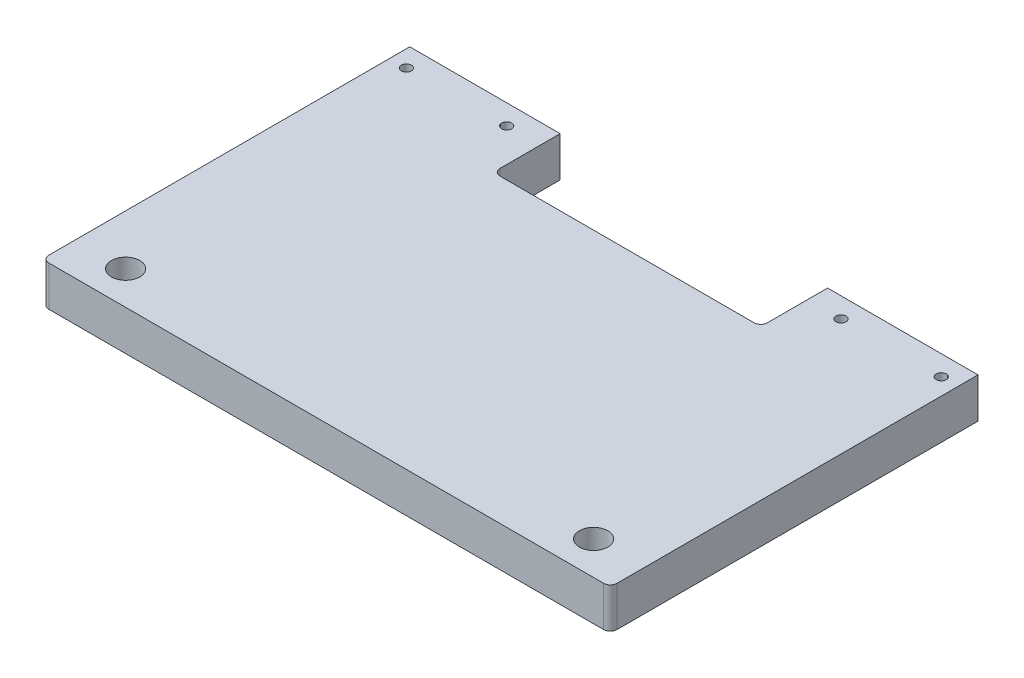
from build123d import *

# Parameters (mm, degrees)
SKETCH1_R           = 4.25
SKETCH1_R_2         = 1.5
BOSS_EXTRUDE1_DEPTH = 12
FILLET1_R           = 2


with BuildPart() as part:
    # Sketch1 → Boss-Extrude1 (new body)
    with BuildSketch(Plane(origin=(0, 0, 0), x_dir=(1, 0, 0), z_dir=(0, 1, 0))):
        Polygon((0, 0), (170, 0), (170, 110), (125, 110), (125, 90), (45, 90), (45, 110), (0, 110), align=None)
        with Locations(Location((155, 10, 0), (0, 0, 270))):
            Circle(SKETCH1_R, mode=Mode.SUBTRACT)
        with Locations(Location((15, 10, 0), (0, 0, 90))):
            Circle(SKETCH1_R, mode=Mode.SUBTRACT)
        with Locations(Location((5, 104, 0), (0, 0, 270))):
            Circle(SKETCH1_R_2, mode=Mode.SUBTRACT)
        with Locations(Location((35, 104, 0), (0, 0, 270))):
            Circle(SKETCH1_R_2, mode=Mode.SUBTRACT)
        with Locations(Location((165, 104, 0), (0, 0, 90))):
            Circle(SKETCH1_R_2, mode=Mode.SUBTRACT)
        with Locations(Location((135, 104, 0), (0, 0, 90))):
            Circle(SKETCH1_R_2, mode=Mode.SUBTRACT)
    extrude(amount=BOSS_EXTRUDE1_DEPTH)

    # Fillet1
    fillet1_edges = [part.edges().sort_by_distance(p)[0] for p in [
        (45, 6, -90),
        (125, 6, -90),
        (170, 6, 0),
        (0, 6, 0),
    ]]
    fillet(fillet1_edges, radius=FILLET1_R)


solid = part.part
